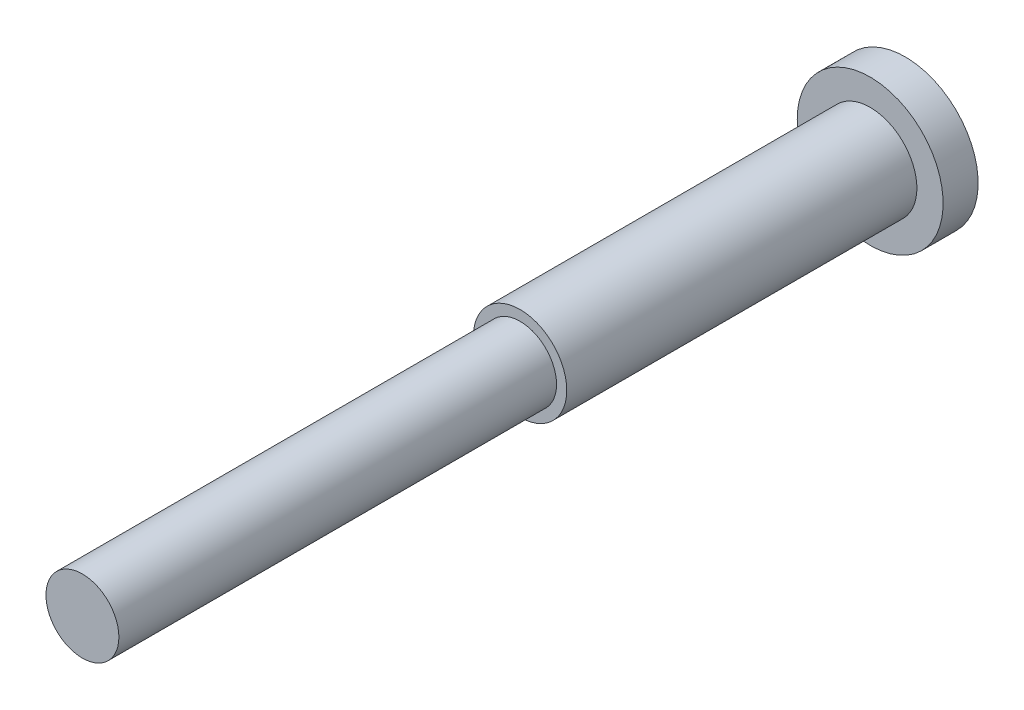
from build123d import *

# Parameters (mm, degrees)
SKETCH1_R           = 8
BASE_EXTRUDE_DEPTH  = 60
SKETCH2_R           = 6.25
BOSS_EXTRUDE1_DEPTH = 75
SKETCH3_R           = 12.5
BOSS_EXTRUDE2_DEPTH = 6


with BuildPart() as part:
    # Sketch1 → Base-Extrude (new body)
    with BuildSketch(Plane.XY):
        Circle(SKETCH1_R)
    extrude(amount=BASE_EXTRUDE_DEPTH)

    # Sketch2 → Boss-Extrude1 (add)
    with BuildSketch(Plane.XY.offset(60)):
        Circle(SKETCH2_R)
    extrude(amount=BOSS_EXTRUDE1_DEPTH)

    # Sketch3 → Boss-Extrude2 (add)
    with BuildSketch(Plane(origin=(0, 0, 0), x_dir=(-1, 0, 0), z_dir=(0, 0, -1))):
        Circle(SKETCH3_R)
    extrude(amount=BOSS_EXTRUDE2_DEPTH)


solid = part.part
